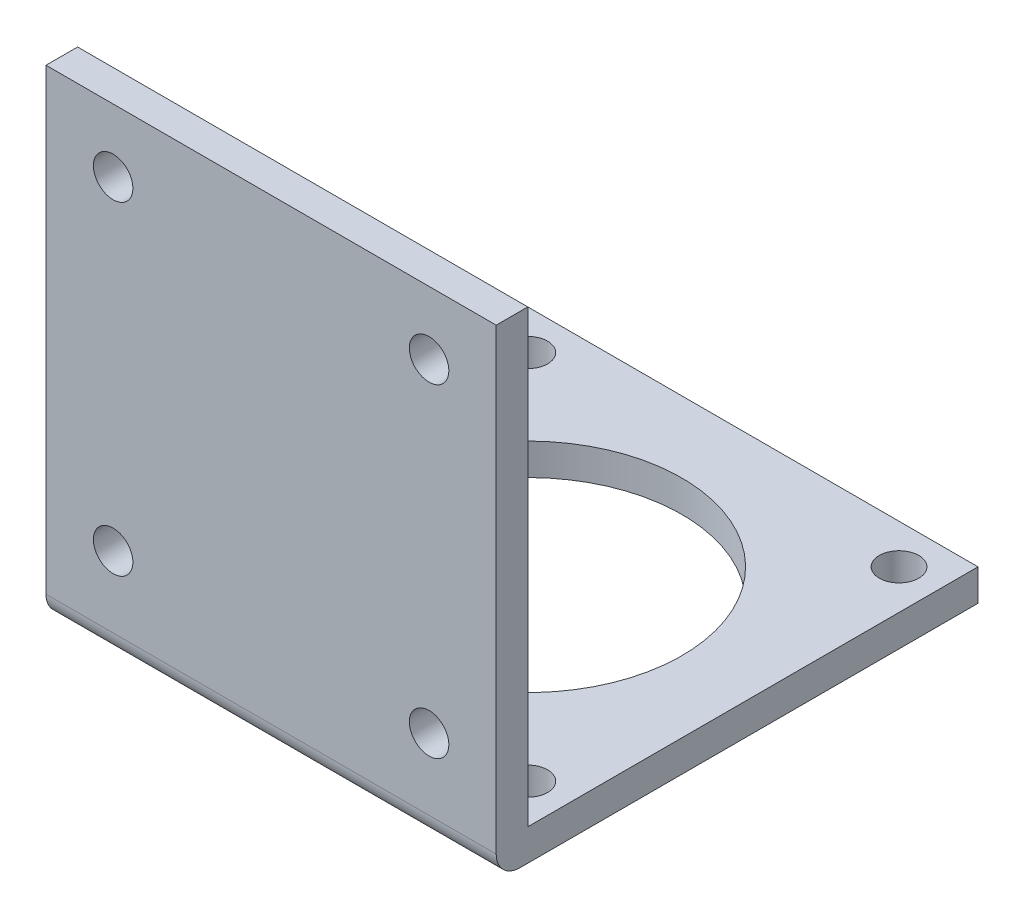
from build123d import *

# Parameters (mm, degrees)
BOSS_EXTRUDE4_DEPTH = 57
FILLET4_R           = 3
SKETCH10_R          = 2.5
SKETCH10_R_2        = 19.5
CUT_EXTRUDE5_DEPTH  = 4
SKETCH11_R          = 2.5
CUT_EXTRUDE6_DEPTH  = 4


with BuildPart() as part:
    # Sketch1 → Boss-Extrude4 (new body)
    with BuildSketch(Plane(origin=(0, 0, 0), x_dir=(0, 0, -1), z_dir=(1, 0, 0))):
        Polygon((0, 0), (0, -61), (61, -61), (61, -57), (4, -57), (4, 0), align=None)
    extrude(amount=BOSS_EXTRUDE4_DEPTH)

    # Fillet4
    fillet4_edges = [part.edges().sort_by_distance(p)[0] for p in [
        (28.5, -61, 0),
    ]]
    fillet(fillet4_edges, radius=FILLET4_R)

    # Sketch10 → Cut-Extrude5 (cut)
    with BuildSketch(Plane(origin=(0, -57, 0), x_dir=(1, 0, 0), z_dir=(0, 1, 0))):
        with Locations(Location((5, 56, 0), (0, 0, 270))):
            Circle(SKETCH10_R)
        with Locations(Location((5, 9, 0), (0, 0, 270))):
            Circle(SKETCH10_R)
        with Locations(Location((52, 9, 0), (0, 0, 270))):
            Circle(SKETCH10_R)
        with Locations(Location((52, 56, 0), (0, 0, 270))):
            Circle(SKETCH10_R)
        with Locations(Location((28.5, 32.5, 0), (0, 0, 270))):
            Circle(SKETCH10_R_2)
    extrude(amount=-CUT_EXTRUDE5_DEPTH, mode=Mode.SUBTRACT)

    # Sketch11 → Cut-Extrude6 (cut)
    with BuildSketch(Plane(origin=(0, 0, -4), x_dir=(-1, 0, 0), z_dir=(0, 0, -1))):
        with Locations((-48.5, -8)):
            Circle(SKETCH11_R)
        with Locations((-48.5, -49)):
            Circle(SKETCH11_R)
        with Locations(Location((-8.5, -49, 0), (0, 0, 90))):
            Circle(SKETCH11_R)
        with Locations(Location((-8.5, -8, 0), (0, 0, 90))):
            Circle(SKETCH11_R)
    extrude(amount=-CUT_EXTRUDE6_DEPTH, mode=Mode.SUBTRACT)


solid = part.part
